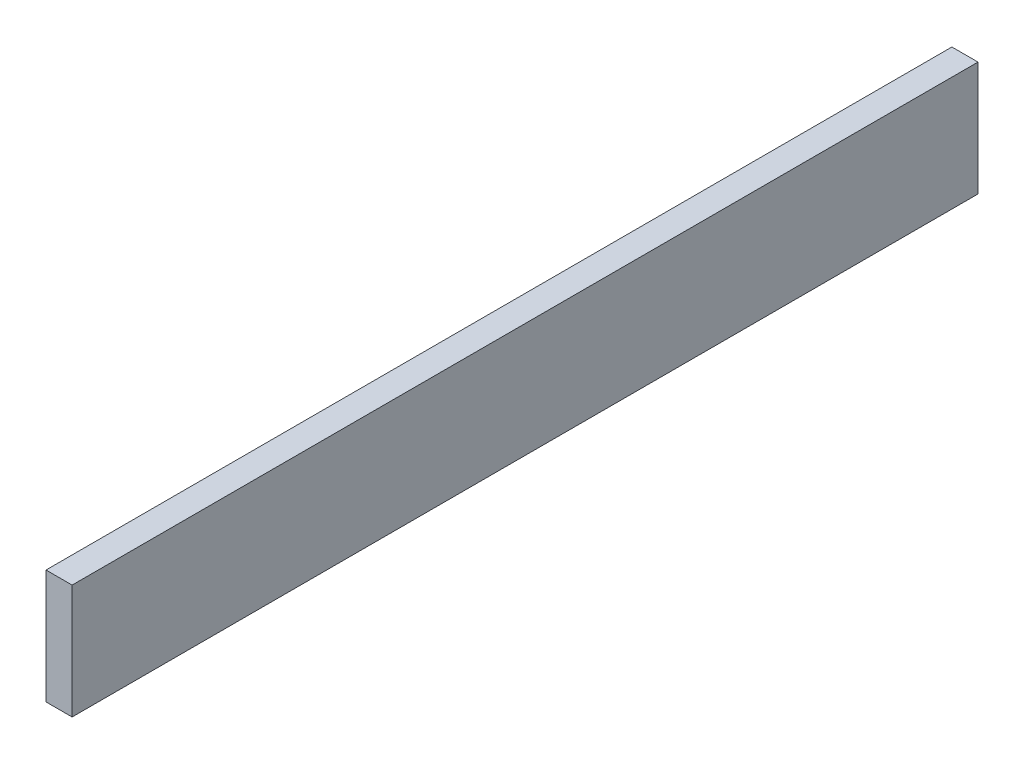
from build123d import *

# Parameters (mm, degrees)
SKETCH1_W           = 555
SKETCH1_H           = 70
BOSS_EXTRUDE1_DEPTH = 16


with BuildPart() as part:
    # Sketch1 → Boss-Extrude1 (new body)
    with BuildSketch(Plane(origin=(0, 0, 0), x_dir=(0, 0, -1), z_dir=(1, 0, 0))):
        with Locations((277.5, 35)):
            Rectangle(SKETCH1_W, SKETCH1_H)
    extrude(amount=BOSS_EXTRUDE1_DEPTH)


solid = part.part
